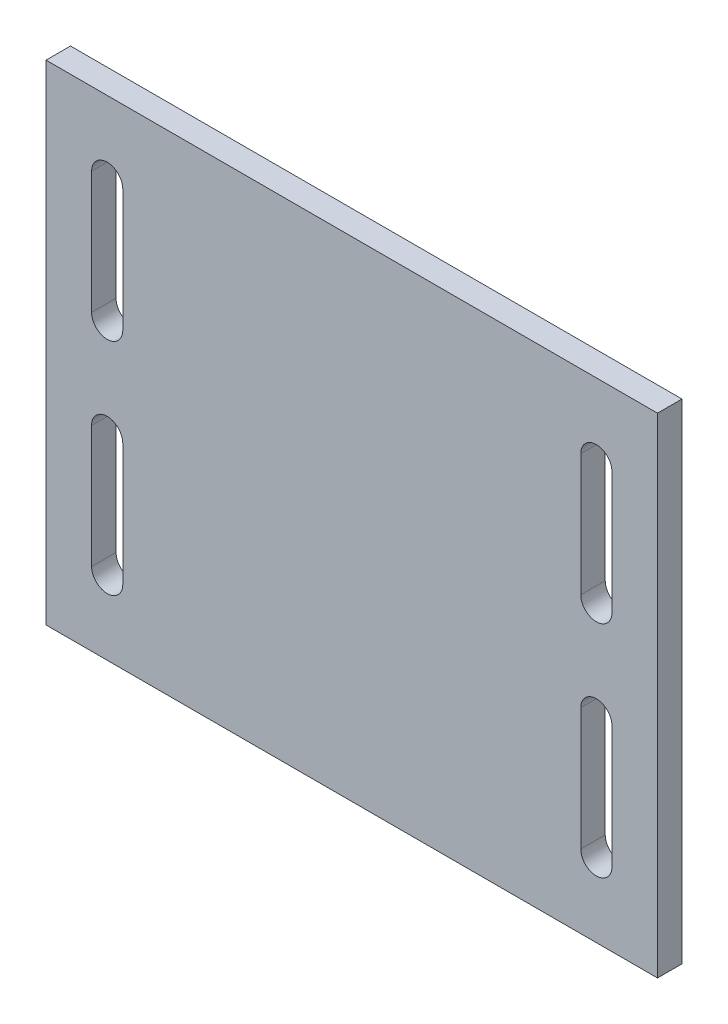
from build123d import *

# Parameters (mm, degrees)
SKETCH1_W           = 100
SKETCH1_H           = 80
BOSS_EXTRUDE1_DEPTH = 4


with BuildPart() as part:
    # Sketch1 → Boss-Extrude1 (new body)
    with BuildSketch(Plane.XY):
        with Locations((50, 40)):
            Rectangle(SKETCH1_W, SKETCH1_H)
        with BuildLine():
            Line((12.55, 68), (12.55, 48))
            ThreePointArc((12.55, 48), (10, 45.45), (7.45, 48))
            Line((7.45, 48), (7.45, 68))
            ThreePointArc((7.45, 68), (10, 70.55), (12.55, 68))
        make_face(mode=Mode.SUBTRACT)
        with BuildLine():
            Line((12.55, 32), (12.55, 12))
            ThreePointArc((12.55, 12), (10, 9.45), (7.45, 12))
            Line((7.45, 12), (7.45, 32))
            ThreePointArc((7.45, 32), (10, 34.55), (12.55, 32))
        make_face(mode=Mode.SUBTRACT)
        with BuildLine():
            Line((92.55, 68), (92.55, 48))
            ThreePointArc((92.55, 48), (90, 45.45), (87.45, 48))
            Line((87.45, 48), (87.45, 68))
            ThreePointArc((87.45, 68), (90, 70.55), (92.55, 68))
        make_face(mode=Mode.SUBTRACT)
        with BuildLine():
            Line((92.55, 32), (92.55, 12))
            ThreePointArc((92.55, 12), (90, 9.45), (87.45, 12))
            Line((87.45, 12), (87.45, 32))
            ThreePointArc((87.45, 32), (90, 34.55), (92.55, 32))
        make_face(mode=Mode.SUBTRACT)
    extrude(amount=BOSS_EXTRUDE1_DEPTH)


solid = part.part
